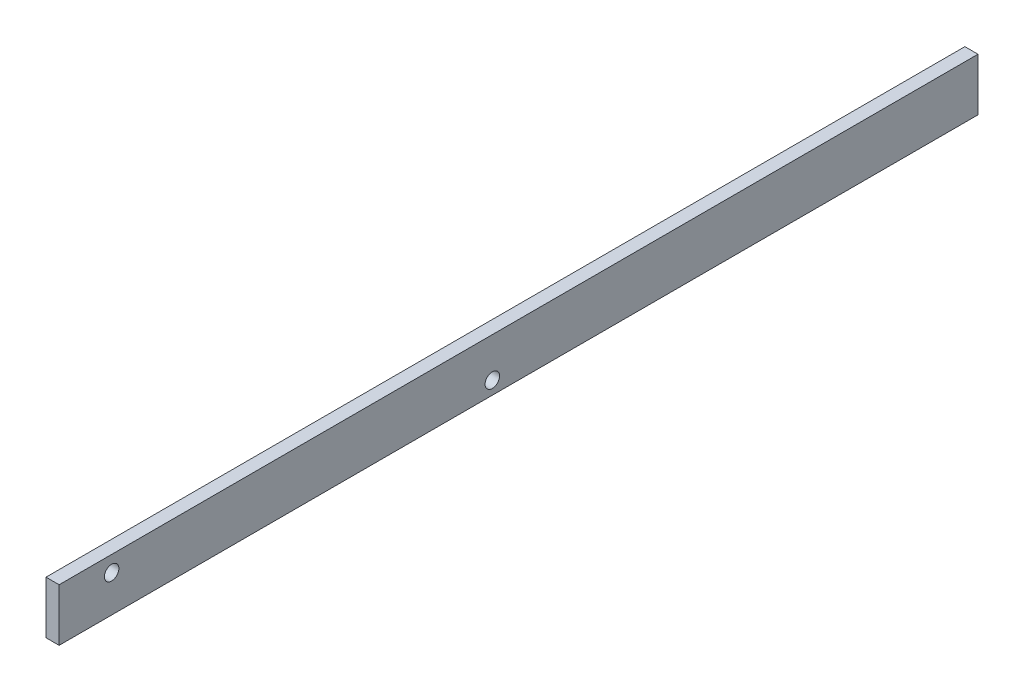
from build123d import *

# Parameters (mm, degrees)
SKETCH1_W                  = 3.175
SKETCH1_H                  = 12.7
BOSS_EXTRUDE1_DEPTH        = 222.25
F_6_0_138_DIAMETER_HOLE1_D = 3.5052
F_6_0_138_DIAMETER_HOLE3_D = 3.5052


with BuildPart() as part:
    # Sketch1 → Boss-Extrude1 (new body)
    with BuildSketch(Plane.XY):
        with Locations((1.5875, -6.35)):
            Rectangle(SKETCH1_W, SKETCH1_H)
    extrude(amount=BOSS_EXTRUDE1_DEPTH)

    # #6 (0.138) Diameter Hole1 (through all)
    with Locations(Plane(origin=(3.175, -3.81, 209.55), x_dir=(0, 1, 0), z_dir=(1, 0, 0))):
        with Locations((0, 0)):
            Hole(F_6_0_138_DIAMETER_HOLE1_D / 2)

    # #6 (0.138) Diameter Hole3 (through all)
    with Locations(Plane(origin=(3.175, -9.525, 117.475), x_dir=(0, 1, 0), z_dir=(1, 0, 0))):
        with Locations((0, 0)):
            Hole(F_6_0_138_DIAMETER_HOLE3_D / 2)


solid = part.part
